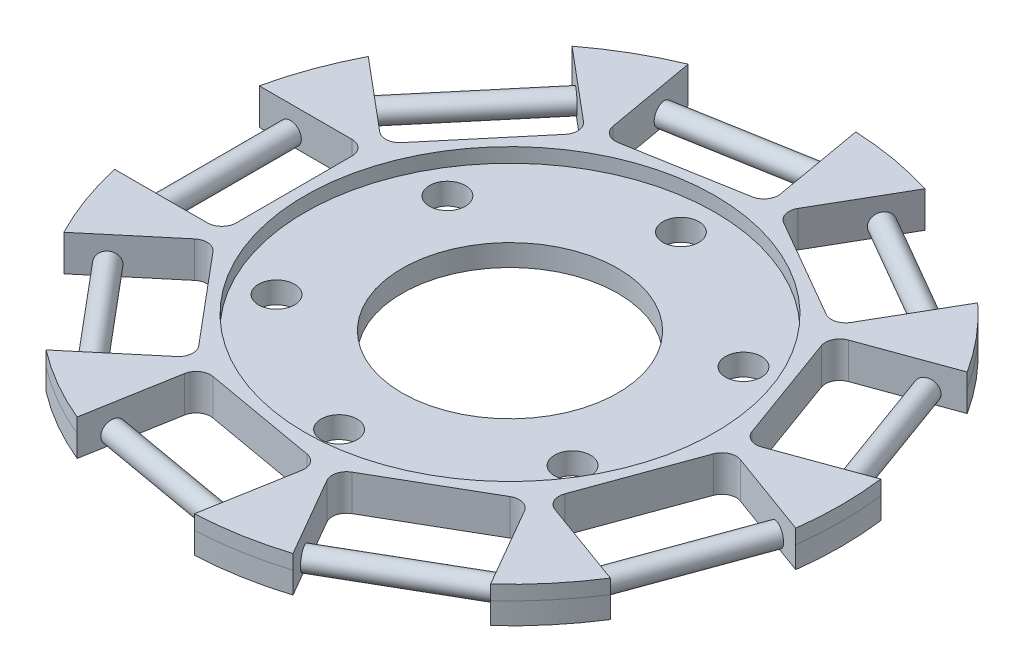
from build123d import *

# Parameters (mm, degrees)
SKETCH_2_R               = 2.5
CUT_EXTRUDE_1_DEPTH      = 10
CUT_EXTRUDE_START        = -10
CUT_EXTRUDE_3_DEPTH      = 10
SKETCH_5_R               = 1.5
EXTRUDE_1_DEPTH          = 20.1
PATTERN_CIRCULAR_8_COUNT = 9
SKETCH_6_R               = 108.516625274
CUT_EXTRUDE_4_DEPTH      = 2


with BuildPart() as part:
    # ｽｹｯﾁ1 → 回転1 (revolve)
    with BuildSketch(Plane.XY, mode=Mode.PRIVATE) as revolve_1_sk:
        Polygon((-15, -3.484577548), (-15, -0.484577548), (-28.5, -0.484577548), (-28.5, 1.515422452), (-46, 1.515422452), (-46, -0.484577548), (-45.9999, -3.484577548), (-46, -5.484577548), (-28.5, -5.484577548), (-28.5, -3.484577548), align=None)
    revolve(revolve_1_sk.sketch.rotate(Axis((0, 0, 0), (0, 1, 0)), 270), axis=Axis((0, 0, 0), (0, 1, 0)))

    # ｽｹｯﾁ2 → ｶｯﾄ - 押し出し1 (cut)
    with BuildSketch(Plane(origin=(0, -0.484577548, 0), x_dir=(1, 0, 0), z_dir=(0, 1, 0))):
        with Locations(Location((0, 23.75, 0), (0, 0, 270))):
            Circle(SKETCH_2_R)
        with Locations(Location((20.56810334, 11.875, 0), (0, 0, 270))):
            Circle(SKETCH_2_R)
        with Locations(Location((20.56810334, -11.875, 0), (0, 0, 270))):
            Circle(SKETCH_2_R)
        with Locations(Location((0, -23.75, 0), (0, 0, 270))):
            Circle(SKETCH_2_R)
        with Locations(Location((-20.56810334, -11.875, 0), (0, 0, 270))):
            Circle(SKETCH_2_R)
        with Locations(Location((-20.56810334, 11.875, 0), (0, 0, 270))):
            Circle(SKETCH_2_R)
    extrude(amount=-CUT_EXTRUDE_1_DEPTH, mode=Mode.SUBTRACT)

    # ｽｹｯﾁ3 → ｶｯﾄ - 押し出し3 (cut)
    with BuildSketch(Plane(origin=(0, 1.515422452, 0), x_dir=(1, 0, 0), z_dir=(0, 1, 0)).offset(CUT_EXTRUDE_START)):
        with BuildLine():
            Line((4.340576232, 33.259012282), (2.102472879, 45.951927139))
            ThreePointArc((2.102472879, 45.951927139), (-7.987816173, 45.301156639), (-17.692162956, 42.461598768))
            Line((-17.692162956, 42.461598768), (-15.454059603, 29.768683911))
            ThreePointArc((-15.454059603, 29.768683911), (-14.63159697, 28.477676178), (-13.137147742, 28.14636476))
            Line((-13.137147742, 28.14636476), (2.718257082, 30.942100421))
            ThreePointArc((2.718257082, 30.942100421), (4.009264815, 31.764563054), (4.340576232, 33.259012282))
        make_face()
        with BuildLine():
            Line((8.0284955, 30.005762114), (21.9715045, 21.955762114))
            ThreePointArc((21.9715045, 21.955762114), (23.489142591, 21.755961269), (24.703555308, 22.687812921))
            Line((24.703555308, 22.687812921), (31.147917072, 33.849774919))
            ThreePointArc((31.147917072, 33.849774919), (23, 39.837168574), (13.740806456, 43.899774919))
            Line((13.740806456, 43.899774919), (7.296444692, 32.737812921))
            ThreePointArc((7.296444692, 32.737812921), (7.096643847, 31.220174831), (8.0284955, 30.005762114))
        make_face()
        with BuildLine():
            ThreePointArc((45.618904696, 5.908936816), (43.225860556, 15.732926593), (38.744299816, 24.796758494))
            Line((38.744299816, 24.796758494), (26.632861425, 20.388555425))
            ThreePointArc((26.632861425, 20.388555425), (25.504286137, 19.354406707), (25.43751647, 17.825129897))
            Line((25.43751647, 17.825129897), (30.944040777, 2.696078702))
            ThreePointArc((30.944040777, 2.696078702), (31.978189495, 1.567503415), (33.507466306, 1.500733748))
            Line((33.507466306, 1.500733748), (45.618904696, 5.908936816))
        make_face()
        with BuildLine():
            ThreePointArc((38.744299816, -24.796758494), (43.225860556, -15.732926593), (45.618904696, -5.908936816))
            Line((45.618904696, -5.908936816), (33.507466306, -1.500733748))
            ThreePointArc((33.507466306, -1.500733748), (31.978189495, -1.567503415), (30.944040777, -2.696078702))
            Line((30.944040777, -2.696078702), (25.43751647, -17.825129897))
            ThreePointArc((25.43751647, -17.825129897), (25.504286137, -19.354406707), (26.632861425, -20.388555425))
            Line((26.632861425, -20.388555425), (38.744299816, -24.796758494))
        make_face()
        with BuildLine():
            ThreePointArc((13.740806456, -43.899774919), (23, -39.837168574), (31.147917072, -33.849774919))
            Line((31.147917072, -33.849774919), (24.703555308, -22.687812921))
            ThreePointArc((24.703555308, -22.687812921), (23.489142591, -21.755961269), (21.9715045, -21.955762114))
            Line((21.9715045, -21.955762114), (8.0284955, -30.005762114))
            ThreePointArc((8.0284955, -30.005762114), (7.096643847, -31.220174831), (7.296444692, -32.737812921))
            Line((7.296444692, -32.737812921), (13.740806456, -43.899774919))
        make_face()
        with BuildLine():
            ThreePointArc((-17.692162956, -42.461598768), (-7.987816173, -45.301156639), (2.102472879, -45.951927139))
            Line((2.102472879, -45.951927139), (4.340576232, -33.259012282))
            ThreePointArc((4.340576232, -33.259012282), (4.009264815, -31.764563054), (2.718257082, -30.942100421))
            Line((2.718257082, -30.942100421), (-13.137147742, -28.14636476))
            ThreePointArc((-13.137147742, -28.14636476), (-14.63159697, -28.477676178), (-15.454059603, -29.768683911))
            Line((-15.454059603, -29.768683911), (-17.692162956, -42.461598768))
        make_face()
        with BuildLine():
            Line((-30.973437657, -12.870456857), (-40.846772695, -21.155168645))
            ThreePointArc((-40.846772695, -21.155168645), (-35.238044383, -29.568230046), (-27.92674174, -36.552661952))
            Line((-27.92674174, -36.552661952), (-18.053406702, -28.267950163))
            ThreePointArc((-18.053406702, -28.267950163), (-17.346592526, -26.910172763), (-17.806893036, -25.450286058))
            Line((-17.806893036, -25.450286058), (-28.155773552, -13.116970523))
            ThreePointArc((-28.155773552, -13.116970523), (-29.513550952, -12.410156347), (-30.973437657, -12.870456857))
        make_face()
        with BuildLine():
            Line((-32, 10.05), (-44.888723528, 10.05))
            ThreePointArc((-44.888723528, 10.05), (-46, 0), (-44.888723528, -10.05))
            Line((-44.888723528, -10.05), (-32, -10.05))
            ThreePointArc((-32, -10.05), (-30.585786438, -9.464213562), (-30, -8.05))
            Line((-30, -8.05), (-30, 8.05))
            ThreePointArc((-30, 8.05), (-30.585786438, 9.464213562), (-32, 10.05))
        make_face()
        with BuildLine():
            Line((-18.053406702, 28.267950163), (-27.92674174, 36.552661952))
            ThreePointArc((-27.92674174, 36.552661952), (-35.238044383, 29.568230046), (-40.846772695, 21.155168645))
            Line((-40.846772695, 21.155168645), (-30.973437657, 12.870456857))
            ThreePointArc((-30.973437657, 12.870456857), (-29.513550952, 12.410156347), (-28.155773552, 13.116970523))
            Line((-28.155773552, 13.116970523), (-17.806893036, 25.450286058))
            ThreePointArc((-17.806893036, 25.450286058), (-17.346592526, 26.910172763), (-18.053406702, 28.267950163))
        make_face()
    extrude(amount=CUT_EXTRUDE_3_DEPTH, mode=Mode.SUBTRACT)

    # ｽｹｯﾁ5 → ﾎﾞｽ - 押し出し1 (add)
    with BuildSketch(Plane(origin=(-9.897317918, 0, 1.745164186), x_dir=(-0.1736481776669516, 0, -0.9848077530122044), z_dir=(0.9848077530122044, 0, -0.1736481776669516))):
        with Locations((40.55, -1.984577548)):
            Circle(SKETCH_5_R)
    extrude_1 = extrude(amount=EXTRUDE_1_DEPTH)

    # 円形ﾊﾟﾀｰﾝ8: ﾎﾞｽ - 押し出し1 ×9 about axis
    pattern_circular_8_axis = Axis((0, 0, 0), (0, -1, 0))
    for i in range(1, PATTERN_CIRCULAR_8_COUNT):
        add(extrude_1.rotate(pattern_circular_8_axis, i * 360 / PATTERN_CIRCULAR_8_COUNT))

    # ｽｹｯﾁ6 → ｶｯﾄ - 押し出し4 (cut)
    with BuildSketch(Plane.XZ.offset(5.484577548)):
        Circle(SKETCH_6_R)
    extrude(amount=-CUT_EXTRUDE_4_DEPTH, mode=Mode.SUBTRACT)


solid = part.part
